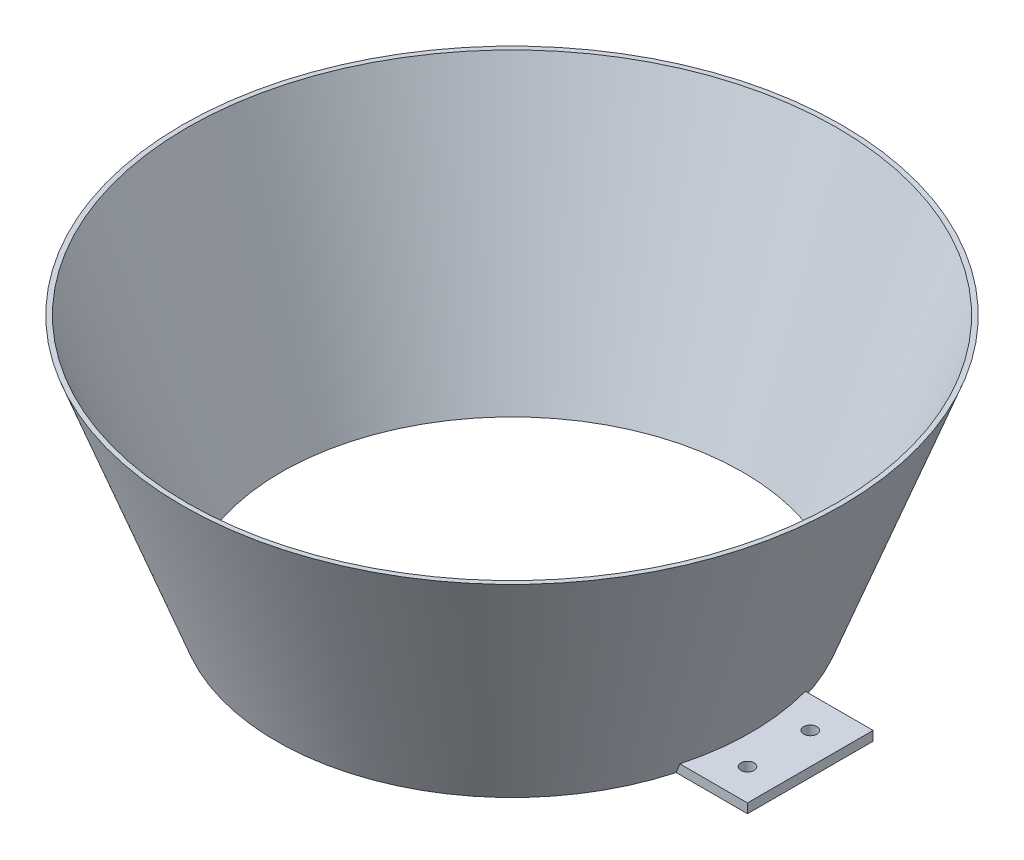
from build123d import *

# Parameters (mm, degrees)
BOSS_EXTRUDE1_DEPTH = 3
SKETCH3_R           = 2.1
CUT_EXTRUDE1_DEPTH  = 3


with BuildPart() as part:
    # Sketch1 → Revolve1 (revolve)
    with BuildSketch(Plane.XY, mode=Mode.PRIVATE) as revolve1_sk:
        Polygon((73.5, 0), (75, 0), (105, 80), (103.5, 80), align=None)
    revolve(revolve1_sk.sketch.rotate(Axis((0, 0, 0), (0, 1, 0)), 90), axis=Axis((0, 0, 0), (0, 1, 0)))

    # Sketch2 → Boss-Extrude1 (add)
    with BuildSketch(Plane.XZ):
        with BuildLine():
            Line((72.284161474, -20), (95, -20))
            Line((95, -20), (95, 20))
            Line((95, 20), (72.284161474, 20))
            ThreePointArc((72.284161474, 20), (75, 0), (72.284161474, -20))
        make_face()
        with BuildLine():
            Line((-95, 20), (-72.284161474, 20))
            ThreePointArc((-72.284161474, 20), (-75, 0), (-72.284161474, -20))
            Line((-72.284161474, -20), (-95, -20))
            Line((-95, -20), (-95, 20))
        make_face()
    extrude(amount=-BOSS_EXTRUDE1_DEPTH)

    # Sketch3 → Cut-Extrude1 (cut)
    with BuildSketch(Plane.XZ):
        with Locations(Location((85, 10, 0), (0, 0, 270))):
            Circle(SKETCH3_R)
        with Locations(Location((85, -10, 0), (0, 0, 90))):
            Circle(SKETCH3_R)
        with Locations(Location((-85, -10, 0), (0, 0, 270))):
            Circle(SKETCH3_R)
        with Locations(Location((-85, 10, 0), (0, 0, 90))):
            Circle(SKETCH3_R)
    extrude(amount=-CUT_EXTRUDE1_DEPTH, mode=Mode.SUBTRACT)


solid = part.part
